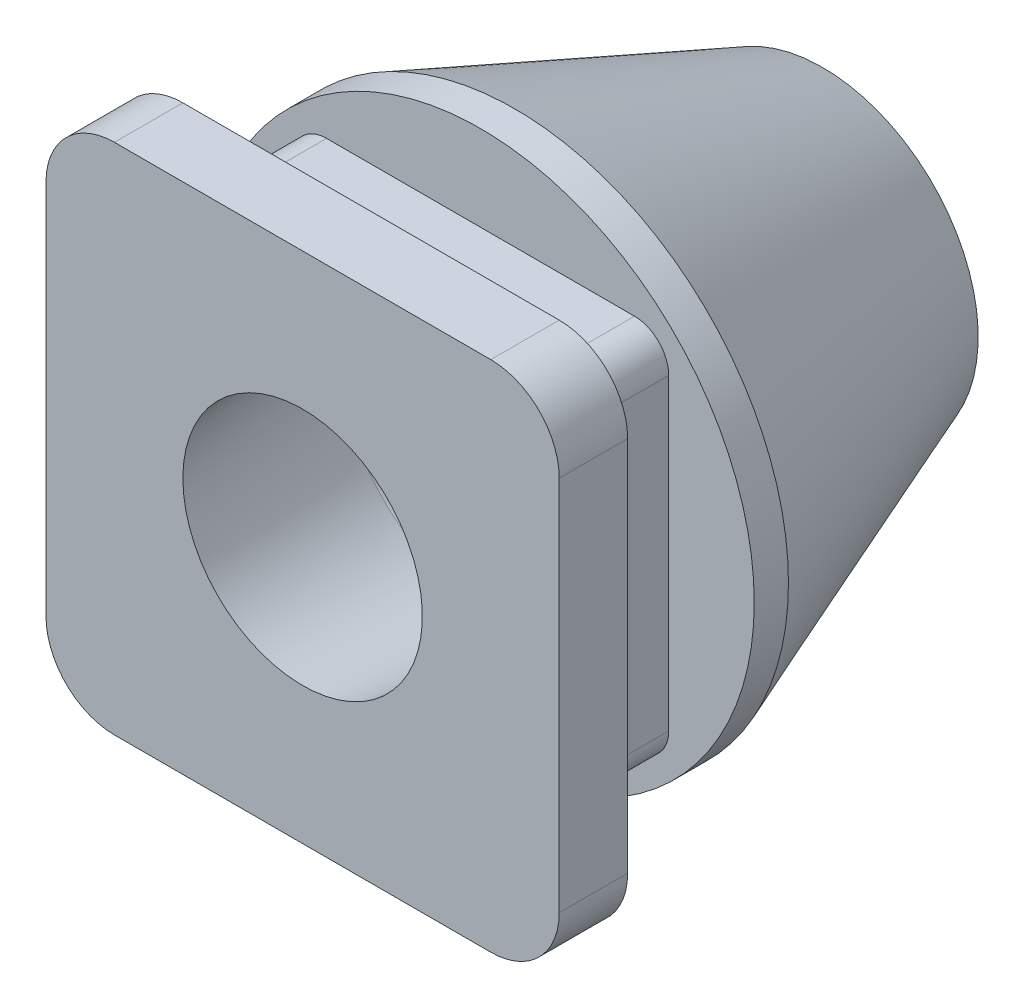
from build123d import *
from build123d.topology import SkipClean

# Parameters (mm, degrees)
SKETCH1_W           = 15
SKETCH1_H           = 15
SKETCH1_R           = 4
BOSS_EXTRUDE1_DEPTH = 2
BOSS_EXTRUDE2_START = 3.2
SKETCH2_W           = 11
SKETCH2_H           = 11
SKETCH2_R           = 4
BOSS_EXTRUDE2_DEPTH = 3.2
BOSS_EXTRUDE3_START = 10
SKETCH3_R           = 8
SKETCH3_R_2         = 4
BOSS_EXTRUDE3_DEPTH = 10
CHAMFER1_SIZE       = 9
CHAMFER1_SIZE2      = 3.454776315
FILLET1_R           = 2
FILLET2_R           = 1


with BuildPart() as part:
    # Sketch1 → Boss-Extrude1 (new body)
    with BuildSketch(Plane.XY):
        Rectangle(SKETCH1_W, SKETCH1_H)
        Circle(SKETCH1_R, mode=Mode.SUBTRACT)
    extrude(amount=BOSS_EXTRUDE1_DEPTH)

    # Sketch2 → Boss-Extrude2 (add)
    with SkipClean():  # the faces are left unmerged after this step: merging them gives an invalid solid
        with BuildSketch(Plane(origin=(0, 0, 0), x_dir=(-1, 0, 0), z_dir=(0, 0, -1)).offset(BOSS_EXTRUDE2_START)):
            Rectangle(SKETCH2_W, SKETCH2_H)
            Circle(SKETCH2_R, mode=Mode.SUBTRACT)
        extrude(amount=-BOSS_EXTRUDE2_DEPTH)

    # Sketch3 → Boss-Extrude3 (add)
    with SkipClean():  # the faces are left unmerged after this step: merging them gives an invalid solid
        with BuildSketch(Plane(origin=(0, 0, -3.2), x_dir=(-1, 0, 0), z_dir=(0, 0, -1)).offset(BOSS_EXTRUDE3_START)):
            Circle(SKETCH3_R)
            Circle(SKETCH3_R_2, mode=Mode.SUBTRACT)
        extrude(amount=-BOSS_EXTRUDE3_DEPTH)

    # Sketch4 → Revolve1 (revolve)
    with BuildSketch(Plane(origin=(0, 0, 0), x_dir=(1, 0, 0), z_dir=(0, 1, 0))):
        Polygon((-4, -2), (-3.5, -2), (-4, 3.2), align=None)
    revolve(axis=Axis((0, 0, -13.2), (0, 0, 1)))

    # Chamfer1
    chamfer1_edges = [part.edges().sort_by_distance(p)[0] for p in [
        (8, 0, -13.2),
    ]]
    chamfer1_side = [part.faces().sort_by_distance(p)[0] for p in [
        (8, 0, -8.2),
    ]]
    chamfer(chamfer1_edges, length=CHAMFER1_SIZE, length2=CHAMFER1_SIZE2, reference=chamfer1_side[0])

    # Fillet1
    fillet1_edges = [part.edges().sort_by_distance(p)[0] for p in [
        (7.5, -7.5, 1),
        (-7.5, -7.5, 1),
        (-7.5, 7.5, 1),
        (7.5, 7.5, 1),
    ]]
    fillet(fillet1_edges, radius=FILLET1_R)

    # Fillet2
    fillet2_edges = [part.edges().sort_by_distance(p)[0] for p in [
        (-5.5, -5.5, -1.6),
        (-5.5, 5.5, -1.6),
        (5.5, 5.5, -1.6),
        (5.5, -5.5, -1.6),
    ]]
    fillet(fillet2_edges, radius=FILLET2_R)


solid = part.part
